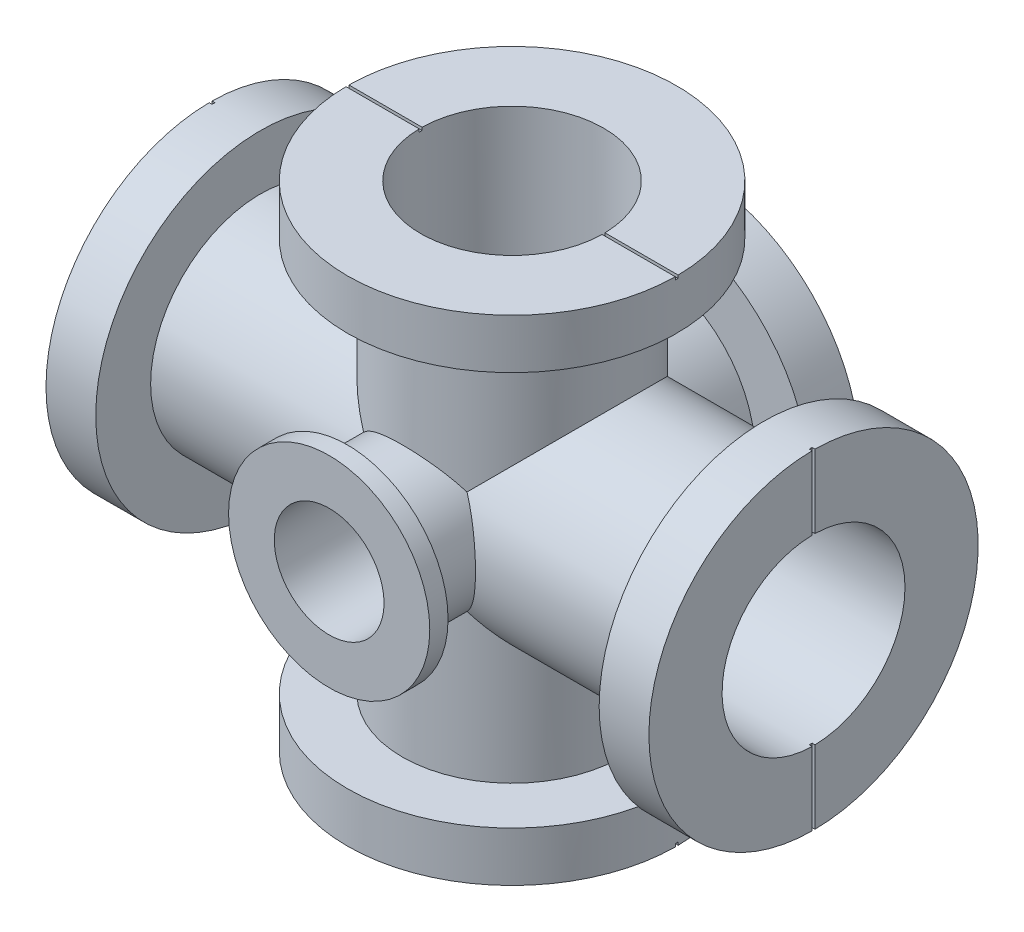
from build123d import *
from build123d.topology import SkipClean

# Parameters (mm, degrees)
SKETCH5_R          = 19.05
CUT_EXTRUDE1_DEPTH = 63.5
CUT_EXTRUDE2_START = -63.5
SKETCH6_R          = 31.75
CUT_EXTRUDE2_DEPTH = 63.5
SKETCH7_R          = 31.75
CUT_EXTRUDE3_DEPTH = 235.916668869
SKETCH8_R          = 31.75
CUT_EXTRUDE4_DEPTH = 211.662185672
SKETCH9_W          = 1
SKETCH9_H          = 1
CUT_EXTRUDE5_DEPTH = 211.662185672
SKETCH10_W         = 1
SKETCH10_H         = 1
CUT_EXTRUDE6_DEPTH = 235.916668869


with BuildPart() as part:
    # Sketch1 → Revolve2 (revolve)
    with BuildSketch(Plane(origin=(0, 0, 0), x_dir=(0, 0, -1), z_dir=(1, 0, 0)), mode=Mode.PRIVATE) as revolve2_sk:
        Polygon((-63.5, 19.05), (-63.5, 34.925), (-57.15, 34.925), (-57.15, 25.4), (0, 25.4), (0, 19.05), align=None)
        Polygon((0, 38.1), (46.228, 38.1), (46.228, 57.15), (63.5, 57.15), (63.5, 31.75), (0, 31.75), align=None)
    revolve(revolve2_sk.sketch.rotate(Axis((0, 0, 80.906165812), (0, 0, -1)), 90), axis=Axis((0, 0, 80.906165812), (0, 0, -1)))

    # Sketch2 → Revolve3 (revolve)
    with BuildSketch(Plane(origin=(0, 0, 0), x_dir=(1, 0, 0), z_dir=(0, 1, 0)), mode=Mode.PRIVATE) as revolve3_sk:
        Polygon((-104.648, 31.75), (-104.648, 57.15), (-87.376, 57.15), (-87.376, 38.1), (87.376, 38.1), (87.376, 57.15), (104.648, 57.15), (104.648, 31.75), align=None)
    revolve(revolve3_sk.sketch.rotate(Axis((-75.637974792, 0, 0), (1, 0, 0)), 180), axis=Axis((-75.637974792, 0, 0), (1, 0, 0)))

    # Sketch3 → Revolve4 (revolve)
    with BuildSketch(Plane.XY, mode=Mode.PRIVATE) as revolve4_sk:
        Polygon((-38.1, -68.453), (-38.1, 68.453), (-57.15, 68.453), (-57.15, 85.725), (-31.75, 85.725), (-31.75, -85.725), (-57.15, -85.725), (-57.15, -68.453), align=None)
    revolve(revolve4_sk.sketch.rotate(Axis((0, 84.837038985, 0), (0, -1, 0)), 270), axis=Axis((0, 84.837038985, 0), (0, -1, 0)))

    # Sketch5 → Cut-Extrude1 (cut)
    with BuildSketch(Plane.XY.offset(63.5)):
        Circle(SKETCH5_R)
    extrude(amount=-CUT_EXTRUDE1_DEPTH, mode=Mode.SUBTRACT)

    # Sketch6 → Cut-Extrude2 (cut)
    with SkipClean():  # the faces are left unmerged after this step: merging them gives an invalid solid
        with BuildSketch(Plane(origin=(0, 0, -63.5), x_dir=(-1, 0, 0), z_dir=(0, 0, -1)).offset(CUT_EXTRUDE2_START)):
            with Locations(Location((0, 0, 0), (0, 0, 180))):
                Circle(SKETCH6_R)
        extrude(amount=CUT_EXTRUDE2_DEPTH, mode=Mode.SUBTRACT)

    # Sketch7 → Cut-Extrude3 (cut, through all)
    with BuildSketch(Plane.ZY.offset(104.648)):
        Circle(SKETCH7_R)
    extrude(amount=-CUT_EXTRUDE3_DEPTH, mode=Mode.SUBTRACT)

    # Sketch8 → Cut-Extrude4 (cut, through all)
    with BuildSketch(Plane(origin=(0, 85.725, 0), x_dir=(-1, 0, 0), z_dir=(0, 1, 0))):
        with Locations(Location((0, 0, 0), (0, 0, 90))):
            Circle(SKETCH8_R)
    extrude(amount=-CUT_EXTRUDE4_DEPTH, mode=Mode.SUBTRACT)

    # Sketch9 → Cut-Extrude5 (cut, through all)
    with BuildSketch(Plane(origin=(0, 85.725, 0), x_dir=(-1, 0, 0), z_dir=(0, 1, 0))):
        with Locations((0, -63)):
            Rectangle(SKETCH9_W, SKETCH9_H)
        with Locations((104.148, 0)):
            Rectangle(SKETCH9_W, SKETCH9_H)
        with Locations((-104.148, 0)):
            Rectangle(SKETCH9_W, SKETCH9_H)
    extrude(amount=-CUT_EXTRUDE5_DEPTH, mode=Mode.SUBTRACT)

    # Sketch10 → Cut-Extrude6 (cut, through all)
    with BuildSketch(Plane.ZY.offset(104.648)):
        with Locations((0, 85.225)):
            Rectangle(SKETCH10_W, SKETCH10_H)
        with Locations((0, -85.225)):
            Rectangle(SKETCH10_W, SKETCH10_H)
    extrude(amount=-CUT_EXTRUDE6_DEPTH, mode=Mode.SUBTRACT)


solid = part.part
